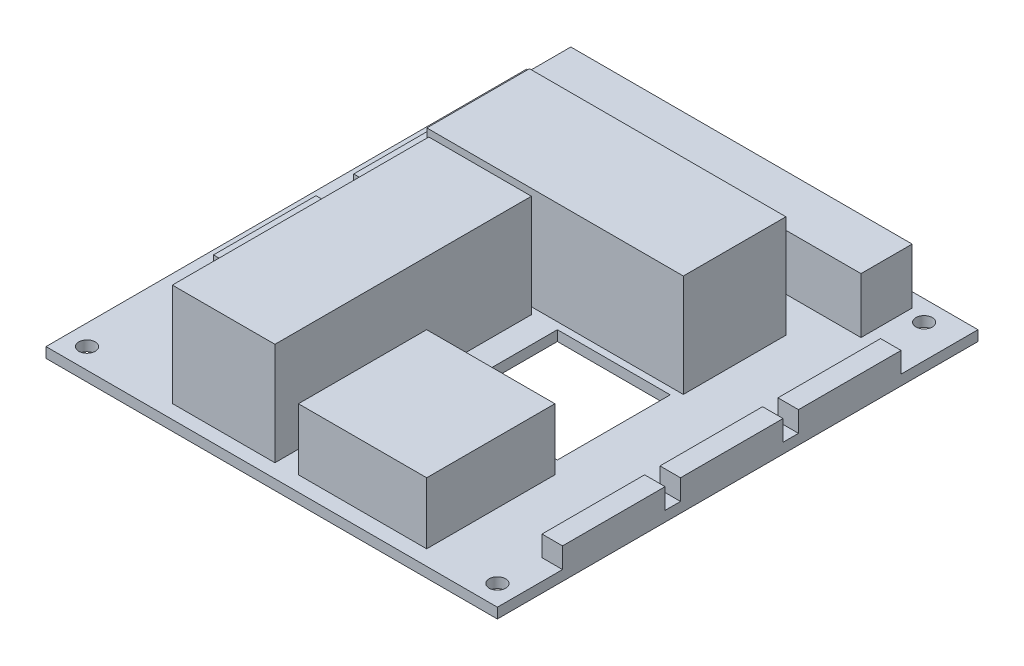
from build123d import *

# Parameters (mm, degrees)
SKETCH3_W           = 88
SKETCH3_H           = 93.7
SKETCH3_R           = 1.6
SKETCH3_W_2         = 22
SKETCH3_H_2         = 22
BOSS_EXTRUDE1_DEPTH = 2
SKETCH4_W           = 66.548
SKETCH4_H           = 9.979
BOSS_EXTRUDE2_DEPTH = 10.8
SKETCH6_W           = 20
SKETCH6_H           = 50
SKETCH6_W_2         = 50
SKETCH6_H_2         = 20
BOSS_EXTRUDE3_DEPTH = 20
SKETCH8_W           = 25
SKETCH8_H           = 25
BOSS_EXTRUDE4_DEPTH = 12
SKETCH9_W           = 4
SKETCH9_H           = 20
BOSS_EXTRUDE5_DEPTH = 4
SKETCH5_W           = 0.635
SKETCH5_H           = 0.635
BOSS_EXTRUDE6_DEPTH = 12


with BuildPart() as part:
    # Sketch3 → Boss-Extrude1 (new body)
    with BuildSketch(Plane(origin=(0, 0, 0), x_dir=(1, 0, 0), z_dir=(0, 1, 0))):
        Rectangle(SKETCH3_W, SKETCH3_H)
        with Locations(Location((-40, -42.85, 0), (0, 0, 270))):
            Circle(SKETCH3_R, mode=Mode.SUBTRACT)
        with Locations(Location((40, -42.85, 0), (0, 0, 270))):
            Circle(SKETCH3_R, mode=Mode.SUBTRACT)
        with Locations(Location((37.5, 42.85, 0), (0, 0, 270))):
            Circle(SKETCH3_R, mode=Mode.SUBTRACT)
        with Locations(Location((-36.2, 42.85, 0), (0, 0, 270))):
            Circle(SKETCH3_R, mode=Mode.SUBTRACT)
        with Locations((14, -5.15)):
            Rectangle(SKETCH3_W_2, SKETCH3_H_2, mode=Mode.SUBTRACT)
    extrude(amount=BOSS_EXTRUDE1_DEPTH)

    # Sketch6 → Boss-Extrude3 (add)
    with BuildSketch(Plane(origin=(0, 2, 0), x_dir=(1, 0, 0), z_dir=(0, 1, 0))):
        with Locations((-12.06875749, -19.15)):
            Rectangle(SKETCH6_W, SKETCH6_H)
        with Locations((1.20970714, 17.191492645)):
            Rectangle(SKETCH6_W_2, SKETCH6_H_2)
    extrude(amount=BOSS_EXTRUDE3_DEPTH)

    # Sketch8 → Boss-Extrude4 (add)
    with BuildSketch(Plane(origin=(0, 2, 0), x_dir=(1, 0, 0), z_dir=(0, 1, 0))):
        with Locations((14.757057682, -31.391931197)):
            Rectangle(SKETCH8_W, SKETCH8_H)
    extrude(amount=BOSS_EXTRUDE4_DEPTH)

    # Sketch9 → Boss-Extrude5 (add)
    with BuildSketch(Plane(origin=(0, 2, 0), x_dir=(1, 0, 0), z_dir=(0, 1, 0))):
        with Locations((42, -24.15)):
            Rectangle(SKETCH9_W, SKETCH9_H)
        with Locations((42, -1.15)):
            Rectangle(SKETCH9_W, SKETCH9_H)
        with Locations((42, 21.85)):
            Rectangle(SKETCH9_W, SKETCH9_H)
        with Locations((-37.151783283, 18.292322821)):
            Rectangle(SKETCH9_W, SKETCH9_H)
        with Locations((-37.151783283, -9.051779916)):
            Rectangle(SKETCH9_W, SKETCH9_H)
    extrude(amount=BOSS_EXTRUDE5_DEPTH)



with BuildPart() as body_2:
    # Sketch4 → Boss-Extrude2 (new body)
    with BuildSketch(Plane(origin=(0, 2, 0), x_dir=(1, 0, 0), z_dir=(0, 1, 0))):
        with Locations((0.649, 39.1015)):
            Rectangle(SKETCH4_W, SKETCH4_H)
    extrude(amount=BOSS_EXTRUDE2_DEPTH)


with BuildPart() as part_1:
    add(part.part)

    add(body_2.part)  # Boss-Extrude6 merges body 2
    # Sketch5 → Boss-Extrude6 (add)
    with BuildSketch(Plane.XZ.offset(-2)):
        with Locations((-31.3545, -35.3825)):
            Rectangle(SKETCH5_W, SKETCH5_H)
        with Locations((-28.8145, -35.3825)):
            Rectangle(SKETCH5_W, SKETCH5_H)
        with Locations((-26.2745, -35.3825)):
            Rectangle(SKETCH5_W, SKETCH5_H)
        with Locations((-23.7345, -35.3825)):
            Rectangle(SKETCH5_W, SKETCH5_H)
        with Locations((-21.1945, -35.3825)):
            Rectangle(SKETCH5_W, SKETCH5_H)
        with Locations((-18.6545, -35.3825)):
            Rectangle(SKETCH5_W, SKETCH5_H)
        with Locations((-16.1145, -35.3825)):
            Rectangle(SKETCH5_W, SKETCH5_H)
        with Locations((-13.5745, -35.3825)):
            Rectangle(SKETCH5_W, SKETCH5_H)
        with Locations((-11.0345, -35.3825)):
            Rectangle(SKETCH5_W, SKETCH5_H)
        with Locations((-8.4945, -35.3825)):
            Rectangle(SKETCH5_W, SKETCH5_H)
        with Locations((-5.9545, -35.3825)):
            Rectangle(SKETCH5_W, SKETCH5_H)
        with Locations((-3.4145, -35.3825)):
            Rectangle(SKETCH5_W, SKETCH5_H)
        with Locations((-0.8745, -35.3825)):
            Rectangle(SKETCH5_W, SKETCH5_H)
        with Locations((1.6655, -35.3825)):
            Rectangle(SKETCH5_W, SKETCH5_H)
        with Locations((4.2055, -35.3825)):
            Rectangle(SKETCH5_W, SKETCH5_H)
        with Locations((6.7455, -35.3825)):
            Rectangle(SKETCH5_W, SKETCH5_H)
        with Locations((9.2855, -35.3825)):
            Rectangle(SKETCH5_W, SKETCH5_H)
        with Locations((11.8255, -35.3825)):
            Rectangle(SKETCH5_W, SKETCH5_H)
        with Locations((14.3655, -35.3825)):
            Rectangle(SKETCH5_W, SKETCH5_H)
        with Locations((16.9055, -35.3825)):
            Rectangle(SKETCH5_W, SKETCH5_H)
        with Locations((19.4455, -35.3825)):
            Rectangle(SKETCH5_W, SKETCH5_H)
        with Locations((21.9855, -35.3825)):
            Rectangle(SKETCH5_W, SKETCH5_H)
        with Locations((24.5255, -35.3825)):
            Rectangle(SKETCH5_W, SKETCH5_H)
        with Locations((27.0655, -35.3825)):
            Rectangle(SKETCH5_W, SKETCH5_H)
        with Locations((29.6055, -35.3825)):
            Rectangle(SKETCH5_W, SKETCH5_H)
        with Locations((32.1455, -35.3825)):
            Rectangle(SKETCH5_W, SKETCH5_H)
        with Locations((-28.8145, -37.9225)):
            Rectangle(SKETCH5_W, SKETCH5_H)
        with Locations((-26.2745, -37.9225)):
            Rectangle(SKETCH5_W, SKETCH5_H)
        with Locations((-23.7345, -37.9225)):
            Rectangle(SKETCH5_W, SKETCH5_H)
        with Locations((-21.1945, -37.9225)):
            Rectangle(SKETCH5_W, SKETCH5_H)
        with Locations((-18.6545, -37.9225)):
            Rectangle(SKETCH5_W, SKETCH5_H)
        with Locations((-16.1145, -37.9225)):
            Rectangle(SKETCH5_W, SKETCH5_H)
        with Locations((-13.5745, -37.9225)):
            Rectangle(SKETCH5_W, SKETCH5_H)
        with Locations((-11.0345, -37.9225)):
            Rectangle(SKETCH5_W, SKETCH5_H)
        with Locations((-8.4945, -37.9225)):
            Rectangle(SKETCH5_W, SKETCH5_H)
        with Locations((-5.9545, -37.9225)):
            Rectangle(SKETCH5_W, SKETCH5_H)
        with Locations((-3.4145, -37.9225)):
            Rectangle(SKETCH5_W, SKETCH5_H)
        with Locations((-0.8745, -37.9225)):
            Rectangle(SKETCH5_W, SKETCH5_H)
        with Locations((1.6655, -37.9225)):
            Rectangle(SKETCH5_W, SKETCH5_H)
        with Locations((4.2055, -37.9225)):
            Rectangle(SKETCH5_W, SKETCH5_H)
        with Locations((6.7455, -37.9225)):
            Rectangle(SKETCH5_W, SKETCH5_H)
        with Locations((9.2855, -37.9225)):
            Rectangle(SKETCH5_W, SKETCH5_H)
        with Locations((11.8255, -37.9225)):
            Rectangle(SKETCH5_W, SKETCH5_H)
        with Locations((14.3655, -37.9225)):
            Rectangle(SKETCH5_W, SKETCH5_H)
        with Locations((16.9055, -37.9225)):
            Rectangle(SKETCH5_W, SKETCH5_H)
        with Locations((19.4455, -37.9225)):
            Rectangle(SKETCH5_W, SKETCH5_H)
        with Locations((21.9855, -37.9225)):
            Rectangle(SKETCH5_W, SKETCH5_H)
        with Locations((24.5255, -37.9225)):
            Rectangle(SKETCH5_W, SKETCH5_H)
        with Locations((27.0655, -37.9225)):
            Rectangle(SKETCH5_W, SKETCH5_H)
        with Locations((29.6055, -37.9225)):
            Rectangle(SKETCH5_W, SKETCH5_H)
        with Locations((32.1455, -37.9225)):
            Rectangle(SKETCH5_W, SKETCH5_H)
        with Locations((-28.8145, -40.4625)):
            Rectangle(SKETCH5_W, SKETCH5_H)
        with Locations((-26.2745, -40.4625)):
            Rectangle(SKETCH5_W, SKETCH5_H)
        with Locations((-23.7345, -40.4625)):
            Rectangle(SKETCH5_W, SKETCH5_H)
        with Locations((-21.1945, -40.4625)):
            Rectangle(SKETCH5_W, SKETCH5_H)
        with Locations((-18.6545, -40.4625)):
            Rectangle(SKETCH5_W, SKETCH5_H)
        with Locations((-16.1145, -40.4625)):
            Rectangle(SKETCH5_W, SKETCH5_H)
        with Locations((-13.5745, -40.4625)):
            Rectangle(SKETCH5_W, SKETCH5_H)
        with Locations((-11.0345, -40.4625)):
            Rectangle(SKETCH5_W, SKETCH5_H)
        with Locations((-8.4945, -40.4625)):
            Rectangle(SKETCH5_W, SKETCH5_H)
        with Locations((-5.9545, -40.4625)):
            Rectangle(SKETCH5_W, SKETCH5_H)
        with Locations((-3.4145, -40.4625)):
            Rectangle(SKETCH5_W, SKETCH5_H)
        with Locations((-0.8745, -40.4625)):
            Rectangle(SKETCH5_W, SKETCH5_H)
        with Locations((1.6655, -40.4625)):
            Rectangle(SKETCH5_W, SKETCH5_H)
        with Locations((4.2055, -40.4625)):
            Rectangle(SKETCH5_W, SKETCH5_H)
        with Locations((6.7455, -40.4625)):
            Rectangle(SKETCH5_W, SKETCH5_H)
        with Locations((9.2855, -40.4625)):
            Rectangle(SKETCH5_W, SKETCH5_H)
        with Locations((11.8255, -40.4625)):
            Rectangle(SKETCH5_W, SKETCH5_H)
        with Locations((14.3655, -40.4625)):
            Rectangle(SKETCH5_W, SKETCH5_H)
        with Locations((16.9055, -40.4625)):
            Rectangle(SKETCH5_W, SKETCH5_H)
        with Locations((19.4455, -40.4625)):
            Rectangle(SKETCH5_W, SKETCH5_H)
        with Locations((21.9855, -40.4625)):
            Rectangle(SKETCH5_W, SKETCH5_H)
        with Locations((24.5255, -40.4625)):
            Rectangle(SKETCH5_W, SKETCH5_H)
        with Locations((27.0655, -40.4625)):
            Rectangle(SKETCH5_W, SKETCH5_H)
        with Locations((29.6055, -40.4625)):
            Rectangle(SKETCH5_W, SKETCH5_H)
        with Locations((32.1455, -40.4625)):
            Rectangle(SKETCH5_W, SKETCH5_H)
        with Locations((-28.8145, -43.0025)):
            Rectangle(SKETCH5_W, SKETCH5_H)
        with Locations((-26.2745, -43.0025)):
            Rectangle(SKETCH5_W, SKETCH5_H)
        with Locations((-23.7345, -43.0025)):
            Rectangle(SKETCH5_W, SKETCH5_H)
        with Locations((-21.1945, -43.0025)):
            Rectangle(SKETCH5_W, SKETCH5_H)
        with Locations((-18.6545, -43.0025)):
            Rectangle(SKETCH5_W, SKETCH5_H)
        with Locations((-16.1145, -43.0025)):
            Rectangle(SKETCH5_W, SKETCH5_H)
        with Locations((-13.5745, -43.0025)):
            Rectangle(SKETCH5_W, SKETCH5_H)
        with Locations((-11.0345, -43.0025)):
            Rectangle(SKETCH5_W, SKETCH5_H)
        with Locations((-8.4945, -43.0025)):
            Rectangle(SKETCH5_W, SKETCH5_H)
        with Locations((-5.9545, -43.0025)):
            Rectangle(SKETCH5_W, SKETCH5_H)
        with Locations((-3.4145, -43.0025)):
            Rectangle(SKETCH5_W, SKETCH5_H)
        with Locations((-0.8745, -43.0025)):
            Rectangle(SKETCH5_W, SKETCH5_H)
        with Locations((1.6655, -43.0025)):
            Rectangle(SKETCH5_W, SKETCH5_H)
        with Locations((4.2055, -43.0025)):
            Rectangle(SKETCH5_W, SKETCH5_H)
        with Locations((6.7455, -43.0025)):
            Rectangle(SKETCH5_W, SKETCH5_H)
        with Locations((9.2855, -43.0025)):
            Rectangle(SKETCH5_W, SKETCH5_H)
        with Locations((11.8255, -43.0025)):
            Rectangle(SKETCH5_W, SKETCH5_H)
        with Locations((14.3655, -43.0025)):
            Rectangle(SKETCH5_W, SKETCH5_H)
        with Locations((16.9055, -43.0025)):
            Rectangle(SKETCH5_W, SKETCH5_H)
        with Locations((19.4455, -43.0025)):
            Rectangle(SKETCH5_W, SKETCH5_H)
        with Locations((21.9855, -43.0025)):
            Rectangle(SKETCH5_W, SKETCH5_H)
        with Locations((24.5255, -43.0025)):
            Rectangle(SKETCH5_W, SKETCH5_H)
        with Locations((27.0655, -43.0025)):
            Rectangle(SKETCH5_W, SKETCH5_H)
        with Locations((29.6055, -43.0025)):
            Rectangle(SKETCH5_W, SKETCH5_H)
        with Locations((32.1455, -43.0025)):
            Rectangle(SKETCH5_W, SKETCH5_H)
        with Locations((-31.3545, -37.9225)):
            Rectangle(SKETCH5_W, SKETCH5_H)
        with Locations((-31.3545, -40.4625)):
            Rectangle(SKETCH5_W, SKETCH5_H)
        with Locations((-31.3545, -43.0025)):
            Rectangle(SKETCH5_W, SKETCH5_H)
    extrude(amount=BOSS_EXTRUDE6_DEPTH)


solid = part_1.part
